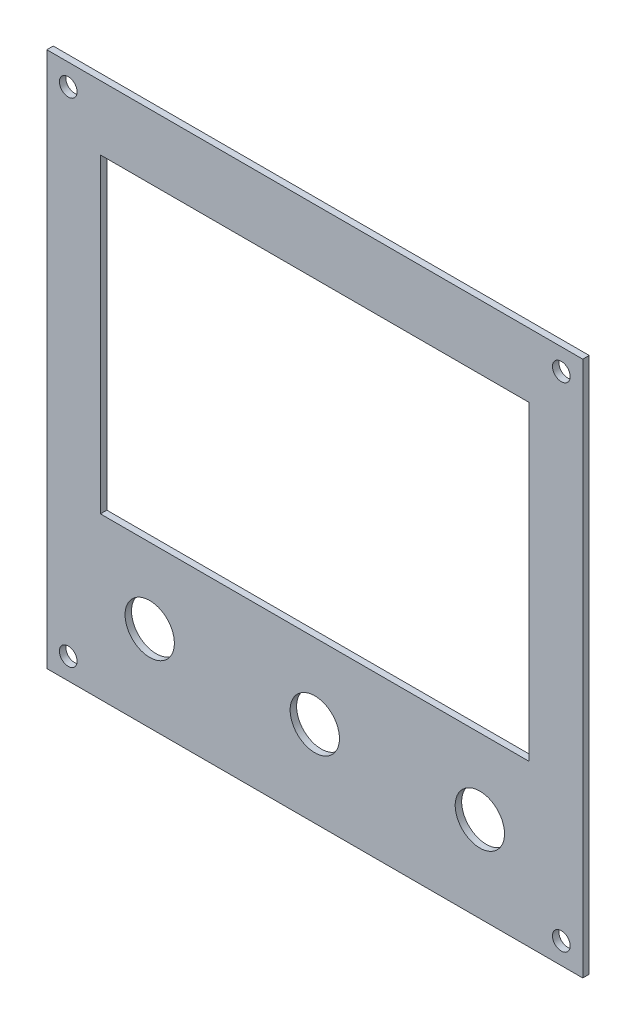
from build123d import *

# Parameters (mm, degrees)
SKETCH1_W           = 250
SKETCH1_H           = 250
SKETCH1_R           = 4.125
SKETCH1_R_2         = 11.5
SKETCH1_W_2         = 200
SKETCH1_H_2         = 145
BOSS_EXTRUDE1_DEPTH = 3


with BuildPart() as part:
    # Sketch1 → Boss-Extrude1 (new body)
    with BuildSketch(Plane.XY):
        Rectangle(SKETCH1_W, SKETCH1_H)
        with Locations((-115, 115)):
            Circle(SKETCH1_R, mode=Mode.SUBTRACT)
        with Locations((115, 115)):
            Circle(SKETCH1_R, mode=Mode.SUBTRACT)
        with Locations((115, -115)):
            Circle(SKETCH1_R, mode=Mode.SUBTRACT)
        with Locations((-115, -115)):
            Circle(SKETCH1_R, mode=Mode.SUBTRACT)
        with Locations((-77, -85)):
            Circle(SKETCH1_R_2, mode=Mode.SUBTRACT)
        with Locations((0, -85)):
            Circle(SKETCH1_R_2, mode=Mode.SUBTRACT)
        with Locations((77, -85)):
            Circle(SKETCH1_R_2, mode=Mode.SUBTRACT)
        with Locations((0, 22.5)):
            Rectangle(SKETCH1_W_2, SKETCH1_H_2, mode=Mode.SUBTRACT)
    extrude(amount=BOSS_EXTRUDE1_DEPTH)


solid = part.part
